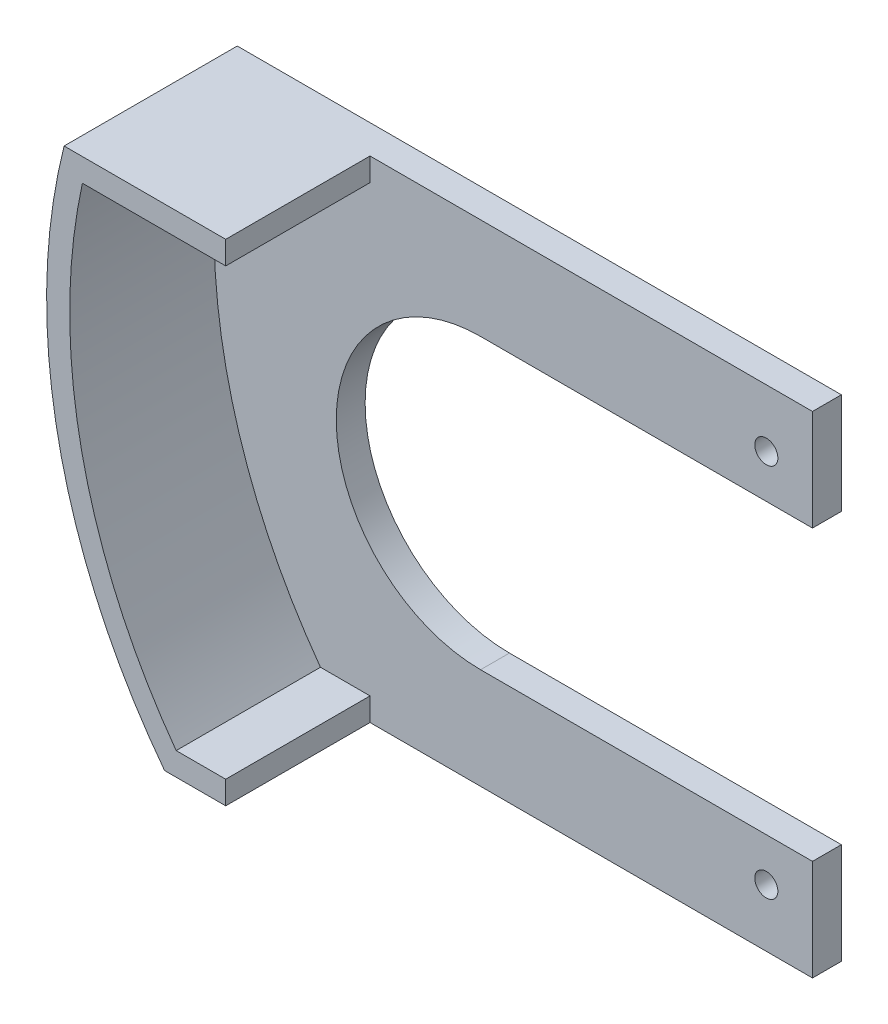
from build123d import *

# Parameters (mm, degrees)
BOSS_EXTRUDE1_DEPTH = 30
SKETCH2_R           = 2
BOSS_EXTRUDE2_DEPTH = 5


with BuildPart() as part:
    # Sketch1 → Boss-Extrude1 (new body)
    with BuildSketch(Plane.XY):
        with BuildLine():
            Line((41.601208794, 42.5), (17.731571651, 42.5))
            ThreePointArc((17.731571651, 42.5), (17.229624056, 40.505148437), (16.770533771, 38.5))
            Line((16.770533771, 38.5), (41.601208794, 38.5))
            Line((41.601208794, 38.5), (41.601208794, 42.5))
        make_face()
        with BuildLine():
            ThreePointArc((13.601208794, 42.5), (12.606987208, -1.986459129), (31.010425159, -42.5))
            Line((31.010425159, -42.5), (36.100142994, -42.5))
            ThreePointArc((36.100142994, -42.5), (34.532590926, -40.520272198), (33.017651358, -38.5))
            ThreePointArc((33.017651358, -38.5), (25.832212825, -27.03194327), (20.330809065, -14.667421089))
            ThreePointArc((20.330809065, -14.667421089), (14.78782202, 11.664315982), (16.770533771, 38.5))
            ThreePointArc((16.770533771, 38.5), (17.229624056, 40.505148437), (17.731571651, 42.5))
            Line((17.731571651, 42.5), (13.601208794, 42.5))
        make_face()
        with BuildLine():
            ThreePointArc((33.017651358, -38.5), (34.532590926, -40.520272198), (36.100142994, -42.5))
            Line((36.100142994, -42.5), (41.601208794, -42.5))
            Line((41.601208794, -42.5), (41.601208794, -38.5))
            Line((41.601208794, -38.5), (33.017651358, -38.5))
        make_face()
    extrude(amount=BOSS_EXTRUDE1_DEPTH)

    # Sketch2 → Boss-Extrude2 (add)
    with BuildSketch(Plane.XY):
        with BuildLine():
            Line((118.251926796, 42.5), (41.601208794, 42.5))
            Line((41.601208794, 42.5), (41.601208794, 38.5))
            Line((41.601208794, 38.5), (16.770533771, 38.5))
            ThreePointArc((16.770533771, 38.5), (16.641534942, -1.741302261), (33.017651358, -38.5))
            Line((33.017651358, -38.5), (41.601208794, -38.5))
            Line((41.601208794, -38.5), (41.601208794, -42.5))
            Line((41.601208794, -42.5), (118.251926796, -42.5))
            Line((118.251926796, -42.5), (118.251926796, -32.5))
            Line((118.251926796, -32.5), (118.251926796, -25))
            Line((118.251926796, -25), (60.751926796, -25))
            ThreePointArc((60.751926796, -25), (35.751926796, 0), (60.751926796, 25))
            Line((60.751926796, 25), (118.251926796, 25))
            Line((118.251926796, 25), (118.251926796, 32.5))
            Line((118.251926796, 32.5), (118.251926796, 42.5))
        make_face()
        with Locations((110.251926796, -32.5)):
            Circle(SKETCH2_R, mode=Mode.SUBTRACT)
        with Locations((20.251926796, 32.5)):
            Circle(SKETCH2_R, mode=Mode.SUBTRACT)
        with Locations((110.251926796, 32.5)):
            Circle(SKETCH2_R, mode=Mode.SUBTRACT)
    extrude(amount=BOSS_EXTRUDE2_DEPTH)


solid = part.part
